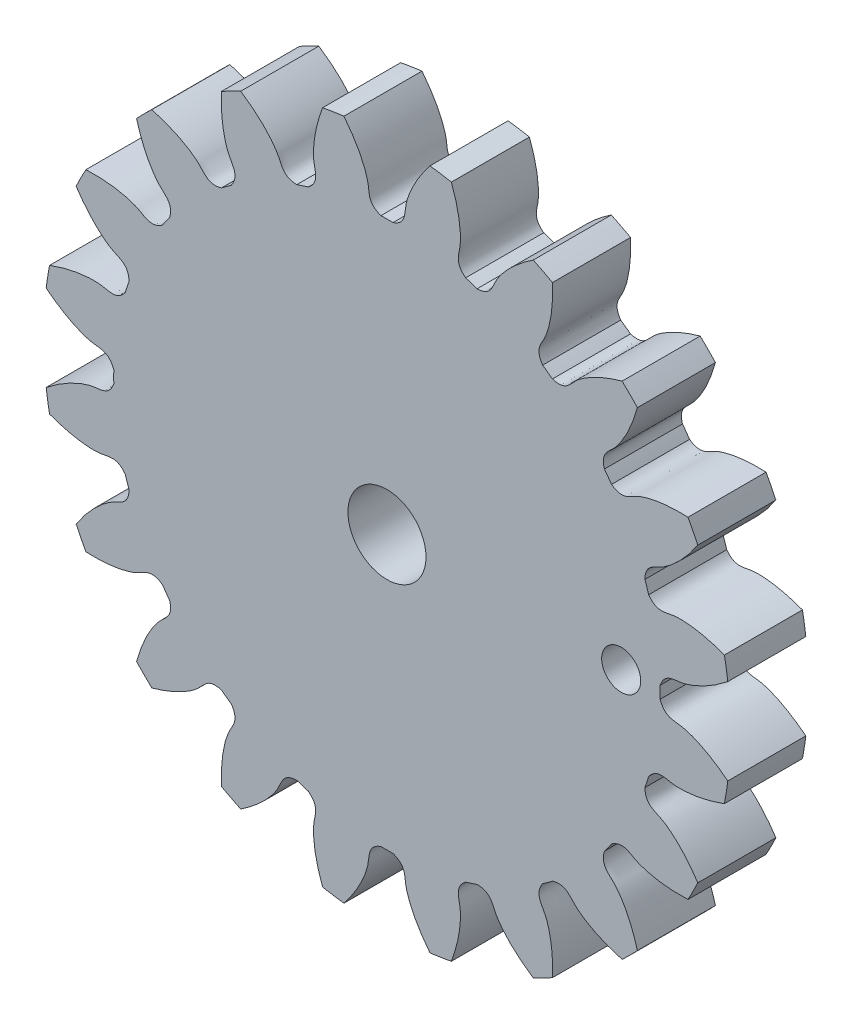
from build123d import *

# Parameters (mm, degrees)
SKETCH_1_R               = 44
EXTRUDE_1_DEPTH          = 10
CUT_EXTRUDE_1_DEPTH      = 64.023805026
PATTERN_CIRCULAR_1_COUNT = 20
SKETCH_4_R               = 5
CUT_EXTRUDE_2_DEPTH      = 10
SKETCH_5_R               = 2.5
CUT_EXTRUDE_3_DEPTH      = 10


with BuildPart() as part:
    # 草图1 → 凸台-拉伸1 (new body)
    with BuildSketch(Plane.XY):
        Circle(SKETCH_1_R)
    extrude(amount=EXTRUDE_1_DEPTH)

    # 草图2 → 切除-拉伸1 (cut, through all)
    with BuildSketch(Plane.XY):
        with BuildLine():
            ThreePointArc((0.773266402, 34.991456944), (0, 35), (-0.773266402, 34.991456944))
            add(Edge.make_bspline(
                [(-0.773266402, 34.991456944), (-2.444757619, 35.573902048), (-2.228336397, 36.748454796), (-2.451588226, 37.88003761), (-2.475568745, 37.990226456), (-2.505243559, 38.114538461), (-2.541168388, 38.252787344), (-2.583916561, 38.404765987), (-2.63404822, 38.570251312), (-2.692119486, 38.749002932), (-2.758679, 38.940763788), (-2.834268399, 39.145260181), (-2.919421594, 39.362202002), (-3.014664409, 39.591282923), (-3.120514125, 39.832180606), (-3.237479058, 40.084556926), (-3.366058134, 40.348058203), (-3.506740467, 40.622315445), (-3.660004954, 40.906944599), (-3.826319863, 41.201546816), (-4.006142438, 41.505708724), (-4.199918505, 41.819002711), (-4.408082086, 42.140987222), (-4.631055023, 42.471207055), (-4.869246604, 42.809193681), (-5.123053203, 43.154465562), (-5.392857922, 43.506528483), (-5.679030247, 43.86487589), (-5.981925706, 44.228989246), (-6.301885541, 44.598338378), (-6.639236386, 44.972381851), (-6.994289955, 45.35056734), (-7.367342737, 45.73233201), (-7.758675705, 46.117102908), (-8.168554026, 46.504297358), (-8.597226794, 46.893323369), (-9.044926758, 47.283580044), (-9.511870073, 47.674457997), (-9.998256047, 48.065339784), (-10.504266937, 48.455600326), (-11.030067598, 48.84460736), (-11.765894363, 49.366559471), (-12.33572965, 49.745330404), (-12.724631927, 49.993007439)],
                knots=[0, 0, 0, 0, 0.165916003, 0.170905922, 0.176663519, 0.183188797, 0.190481754, 0.198542391, 0.207370708, 0.216966704, 0.22733038, 0.238461736, 0.250360771, 0.263027487, 0.276461881, 0.290663956, 0.30563371, 0.321371144, 0.337876258, 0.355149051, 0.373189524, 0.391997677, 0.411573509, 0.431917021, 0.453028213, 0.474907084, 0.497553636, 0.520967867, 0.545149777, 0.570099367, 0.595816637, 0.622301587, 0.649554216, 0.677574526, 0.706362514, 0.735918183, 0.766241531, 0.797332559, 0.829191267, 0.861817654, 0.895211721, 0.929373468, 1, 1, 1, 1], degree=3))
            ThreePointArc((-12.724631927, 49.993007439), (0, 51.586985282), (12.724631927, 49.993007439))
            add(Edge.make_bspline(
                [(0.773266402, 34.991456944), (2.444757619, 35.573902048), (2.228336397, 36.748454796), (2.451588226, 37.88003761), (2.475568745, 37.990226456), (2.505243559, 38.114538461), (2.541168388, 38.252787344), (2.583916561, 38.404765987), (2.63404822, 38.570251312), (2.692119486, 38.749002932), (2.758679, 38.940763788), (2.834268399, 39.145260181), (2.919421594, 39.362202002), (3.014664409, 39.591282923), (3.120514125, 39.832180606), (3.237479058, 40.084556926), (3.366058134, 40.348058203), (3.506740467, 40.622315445), (3.660004954, 40.906944599), (3.826319863, 41.201546816), (4.006142438, 41.505708724), (4.199918505, 41.819002711), (4.408082086, 42.140987222), (4.631055023, 42.471207055), (4.869246604, 42.809193681), (5.123053203, 43.154465562), (5.392857922, 43.506528483), (5.679030247, 43.86487589), (5.981925706, 44.228989246), (6.301885541, 44.598338378), (6.639236386, 44.972381851), (6.994289955, 45.35056734), (7.367342737, 45.73233201), (7.758675705, 46.117102908), (8.168554026, 46.504297358), (8.597226794, 46.893323369), (9.044926758, 47.283580044), (9.511870073, 47.674457997), (9.998256047, 48.065339784), (10.504266937, 48.455600326), (11.030067598, 48.84460736), (11.765894363, 49.366559471), (12.33572965, 49.745330404), (12.724631927, 49.993007439)],
                knots=[0, 0, 0, 0, 0.165916003, 0.170905922, 0.176663519, 0.183188797, 0.190481754, 0.198542391, 0.207370708, 0.216966704, 0.22733038, 0.238461736, 0.250360771, 0.263027487, 0.276461881, 0.290663956, 0.30563371, 0.321371144, 0.337876258, 0.355149051, 0.373189524, 0.391997677, 0.411573509, 0.431917021, 0.453028213, 0.474907084, 0.497553636, 0.520967867, 0.545149777, 0.570099367, 0.595816637, 0.622301587, 0.649554216, 0.677574526, 0.706362514, 0.735918183, 0.766241531, 0.797332559, 0.829191267, 0.861817654, 0.895211721, 0.929373468, 1, 1, 1, 1], degree=3))
        make_face()
    cut_extrude_1 = extrude(amount=CUT_EXTRUDE_1_DEPTH, mode=Mode.SUBTRACT)

    # 阵列(圆周)1: 切除-拉伸1 ×20 about axis
    pattern_circular_1_axis = Axis((0, 0, -1.5), (0, 0, 1))
    for i in range(1, PATTERN_CIRCULAR_1_COUNT):
        add(cut_extrude_1.rotate(pattern_circular_1_axis, i * 360 / PATTERN_CIRCULAR_1_COUNT), mode=Mode.SUBTRACT)

    # 草图4 → 切除-拉伸2 (cut)
    with BuildSketch(Plane.XY.offset(10)):
        Circle(SKETCH_4_R)
    extrude(amount=-CUT_EXTRUDE_2_DEPTH, mode=Mode.SUBTRACT)

    # 草图5 → 切除-拉伸3 (cut)
    with BuildSketch(Plane.XY.offset(10)):
        with Locations((30, 0)):
            Circle(SKETCH_5_R)
    extrude(amount=-CUT_EXTRUDE_3_DEPTH, mode=Mode.SUBTRACT)


solid = part.part
